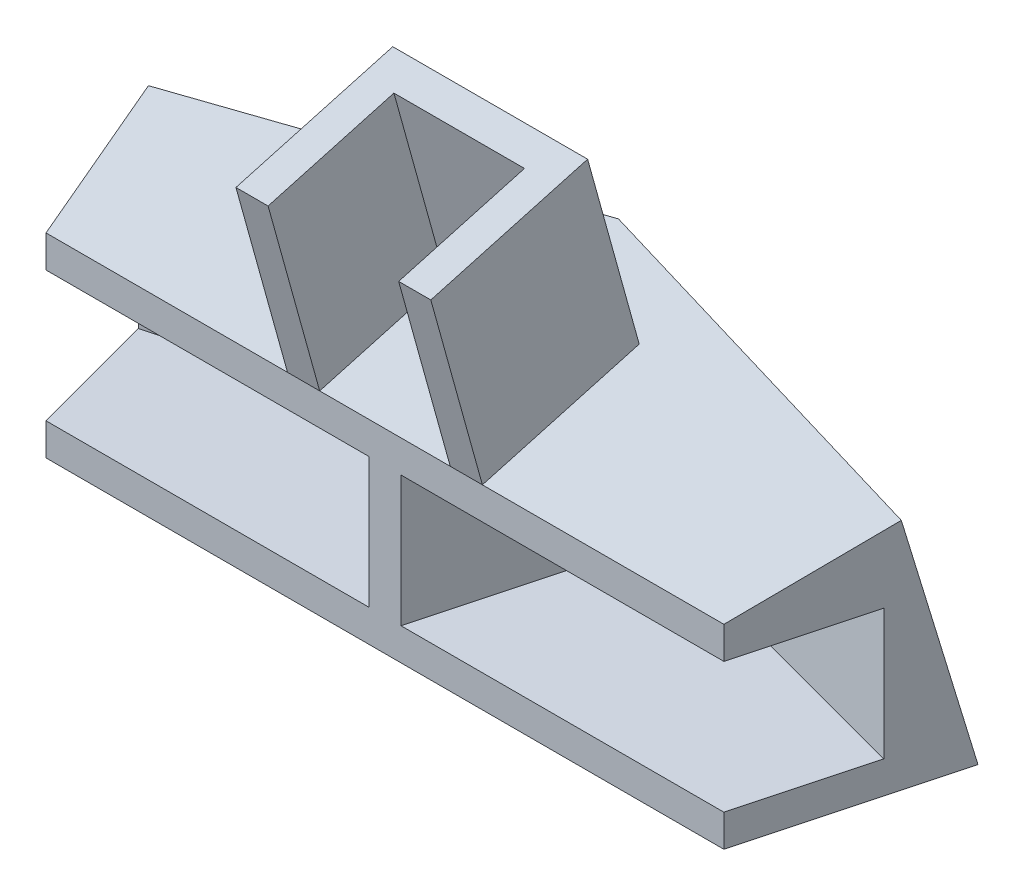
from build123d import *

# Parameters (mm, degrees)
BOSS_EXTRUDE5_DEPTH  = 5
BOSS_EXTRUDE6_DEPTH  = 20.3
BOSS_EXTRUDE7_DEPTH  = 20
CUT_EXTRUDE1_DEPTH   = 90.151426067
CUT_EXTRUDE3_DEPTH   = 84.031866845
BOSS_EXTRUDE9_DEPTH  = 30
BOSS_EXTRUDE11_DEPTH = 20.3


with BuildPart() as part:
    # Sketch8 → Boss-Extrude5 (new body)
    with BuildSketch(Plane(origin=(0, 0, 0), x_dir=(1, 0, 0), z_dir=(0, 1, 0))):
        Polygon((-63.131930479, 24.805480282), (-52.701522962, -14.121330517), (0, -14.121330517), (0, 41.721630071), align=None)
    boss_extrude5 = extrude(amount=BOSS_EXTRUDE5_DEPTH)

    # Sketch9 → Boss-Extrude6 (add)
    with BuildSketch(Plane(origin=(0, 5, 0), x_dir=(1, 0, 0), z_dir=(0, 1, 0))):
        Polygon((-63.131930479, 24.805480282), (-57.955549577, 5.486963756), (0, 21.016106462), (0, 41.721630071), align=None)
    boss_extrude6 = extrude(amount=BOSS_EXTRUDE6_DEPTH)

    # Sketch10 → Boss-Extrude7 (add)
    with BuildSketch(Plane(origin=(0, 25.3, 0), x_dir=(1, 0, 0), z_dir=(0, 1, 0))):
        Polygon((0, 41.721630071), (0, -14.121330517), (-52.701522962, -14.121330517), (-63.131930479, 24.805480282), align=None)
    boss_extrude7 = extrude(amount=BOSS_EXTRUDE7_DEPTH)

    # Sketch19 → Cut-Extrude1 (cut, through all)
    with BuildSketch(Plane(origin=(-52.701522962, 0, 14.121330517), x_dir=(0.25881904510251774, 0, 0.9659258262890692), z_dir=(-0.9659258262890692, 0, 0.25881904510251774))):
        Polygon((-32.255495471, 0), (-20.117397053, 45.3), (-40.3, 45.3), (-40.3, 0), align=None)
    cut_extrude1 = extrude(amount=-CUT_EXTRUDE1_DEPTH, mode=Mode.SUBTRACT)

    # Sketch22 → Cut-Extrude3 (cut, through all)
    with BuildSketch(Plane(origin=(0, 0, 0), x_dir=(0, 0, -1), z_dir=(1, 0, 0))):
        Polygon((-14.121330517, 30.3), (22.193593674, 40.37381141), (20.827061981, 45.3), (-14.121330517, 45.3), align=None)
    cut_extrude3 = extrude(amount=-CUT_EXTRUDE3_DEPTH, mode=Mode.SUBTRACT)

    # Sketch23 → Boss-Extrude9 (add)
    with BuildSketch(Plane(origin=(0, 31.772345951, 8.813693772), x_dir=(1, 0, 0), z_dir=(0, 0.9636113749942826, 0.26730716036355656))):
        Polygon((-10.15, -5.508067758), (-15.15, -5.508067758), (-15.15, 19.791932242), (0, 19.791932242), (0, 14.791932242), (-10.15, 14.791932242), align=None)
    boss_extrude9 = extrude(amount=BOSS_EXTRUDE9_DEPTH)

    # Sketch24 → Boss-Extrude11 (add)
    with BuildSketch(Plane(origin=(0, 5, 0), x_dir=(1, 0, 0), z_dir=(0, 1, 0))):
        Polygon((-2.5, -14.121330517), (-11.116891, 18.037344497), (0, 21.016106462), (0, -14.121330517), align=None)
    boss_extrude11 = extrude(amount=BOSS_EXTRUDE11_DEPTH)

    # Mirror1: Boss-Extrude5, Boss-Extrude6, Boss-Extrude7, Cut-Extrude1, Cut-Extrude3, Boss-Extrude9, Boss-Extrude11 across plane
    add(boss_extrude5.mirror(Plane(origin=(0, 5, -41.721630071), x_dir=(0, 0, 1), z_dir=(-1, 0, 0))))
    add(boss_extrude6.mirror(Plane(origin=(0, 5, -41.721630071), x_dir=(0, 0, 1), z_dir=(-1, 0, 0))))
    add(boss_extrude7.mirror(Plane(origin=(0, 5, -41.721630071), x_dir=(0, 0, 1), z_dir=(-1, 0, 0))))
    add(cut_extrude1.mirror(Plane(origin=(0, 5, -41.721630071), x_dir=(0, 0, 1), z_dir=(-1, 0, 0))), mode=Mode.SUBTRACT)
    add(cut_extrude3.mirror(Plane(origin=(0, 5, -41.721630071), x_dir=(0, 0, 1), z_dir=(-1, 0, 0))), mode=Mode.SUBTRACT)
    add(boss_extrude9.mirror(Plane(origin=(0, 5, -41.721630071), x_dir=(0, 0, 1), z_dir=(-1, 0, 0))))
    add(boss_extrude11.mirror(Plane(origin=(0, 5, -41.721630071), x_dir=(0, 0, 1), z_dir=(-1, 0, 0))))


solid = part.part
